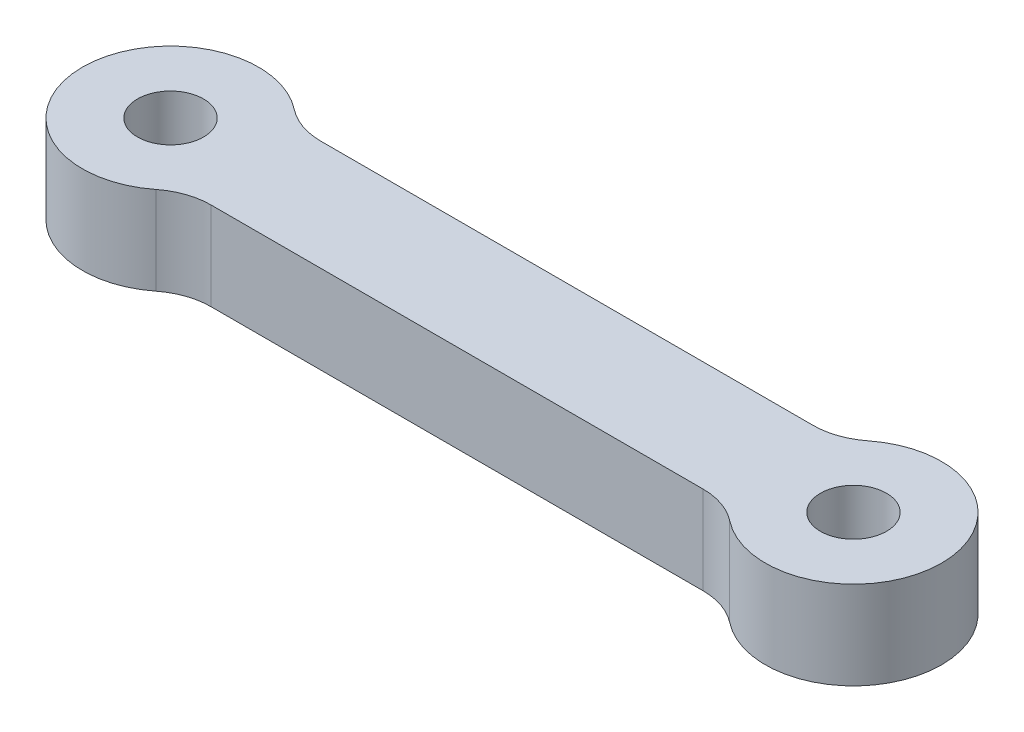
from build123d import *

# Parameters (mm, degrees)
SKETCH1_R           = 1.5
BOSS_EXTRUDE1_DEPTH = 4


with BuildPart() as part:
    # Sketch1 → Boss-Extrude1 (new body)
    with BuildSketch(Plane(origin=(0, 0, 0), x_dir=(1, 0, 0), z_dir=(0, 1, 0))):
        with BuildLine():
            Line((11.169872981, 2.5), (-11.169872981, 2.5))
            ThreePointArc((-11.169872981, 2.5), (-12.151853487, 2.665266452), (-13.025641703, 3.142857143))
            ThreePointArc((-13.025641703, 3.142857143), (-19.5, 0), (-13.025641703, -3.142857143))
            ThreePointArc((-13.025641703, -3.142857143), (-12.151853487, -2.665266452), (-11.169872981, -2.5))
            Line((-11.169872981, -2.5), (11.169872981, -2.5))
            ThreePointArc((11.169872981, -2.5), (12.151853487, -2.665266452), (13.025641703, -3.142857143))
            ThreePointArc((13.025641703, -3.142857143), (19.5, 0), (13.025641703, 3.142857143))
            ThreePointArc((13.025641703, 3.142857143), (12.151853487, 2.665266452), (11.169872981, 2.5))
        make_face()
        with Locations(Location((-15.5, 0, 0), (0, 0, 270))):
            Circle(SKETCH1_R, mode=Mode.SUBTRACT)
        with Locations(Location((15.5, 0, 0), (0, 0, 90))):
            Circle(SKETCH1_R, mode=Mode.SUBTRACT)
    extrude(amount=BOSS_EXTRUDE1_DEPTH)


solid = part.part
